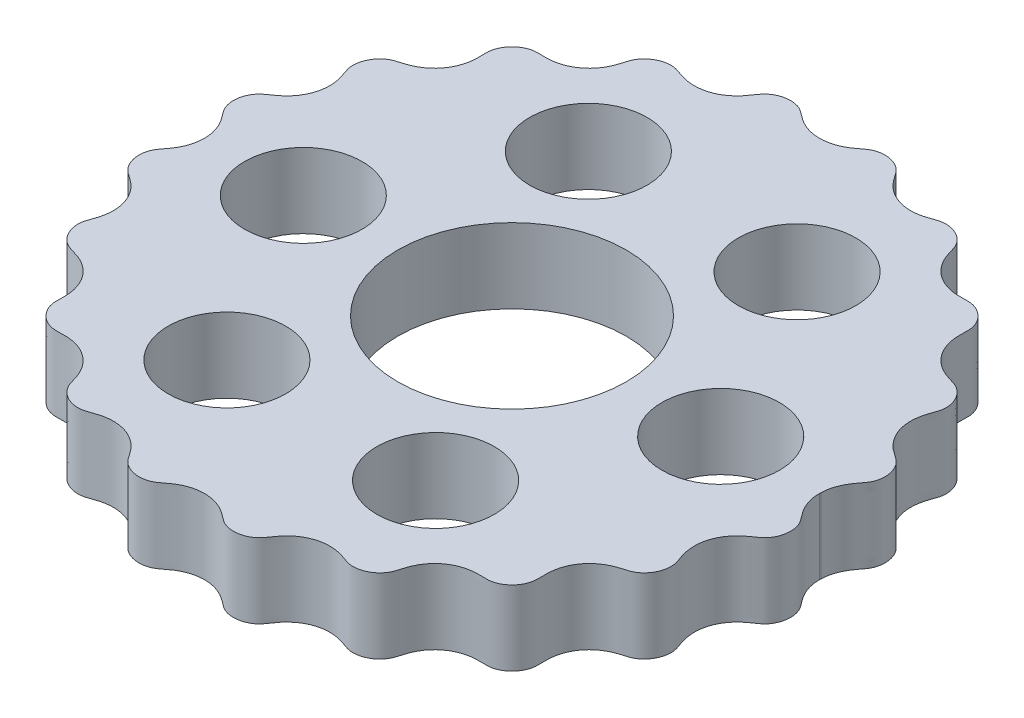
from build123d import *

# Parameters (mm, degrees)
CYCLOIDAL_BASE_SKETCH_R        = 10.4
CYCLOIDAL_BASE_EXTRUSION_DEPTH = 6.8
OUTPUT_HOLES_SKETCH_R          = 5.35
OUTPUT_HOLES_CUTOUT_DEPTH      = 43.495833342


with BuildPart() as part:
    # Cycloidal Base Sketch → Cycloidal Base Extrusion (new body)
    with BuildSketch(Plane(origin=(0, 0, 0), x_dir=(1, 0, 0), z_dir=(0, 1, 0))):
        with BuildLine():
            add(Edge.make_bspline(
                [(28, 0), (28, -0.031031349), (28.000664585, -0.077562013), (28.002880061, -0.148625962), (28.008857323, -0.265030804), (28.01748439, -0.378165866), (28.035377174, -0.532449994), (28.06975465, -0.744031815), (28.124898528, -0.988402272), (28.208291328, -1.260754977), (28.310763489, -1.527479674), (28.432264517, -1.78553412), (28.586475915, -2.065550339), (28.781240437, -2.361249596), (29.013710566, -2.671510887), (29.282434665, -2.997909262), (29.511090265, -3.399330908), (29.650641795, -3.879617947), (29.685943401, -4.415209937), (29.595050036, -4.98366351), (29.393332982, -5.482667687), (29.108390624, -5.897533807), (28.762039685, -6.207243903), (28.403477037, -6.435442884), (28.026266021, -6.701844442), (27.64319557, -7.023691154), (27.180082711, -7.524317118), (26.718464045, -8.267029277), (26.411916475, -9.252490746), (26.412585588, -10.23832478), (26.591144298, -11.003215534), (26.788245534, -11.554847613), (26.926996187, -11.920540426), (27.04353273, -12.498351115), (26.949273296, -13.292291113), (26.579231695, -14.011203462), (25.979864827, -14.553993599), (25.426081192, -14.793657027), (25.031899301, -14.895827838), (24.598577298, -15.029618089), (24.134125138, -15.214708043), (23.655411415, -15.480342094), (23.184349595, -15.840952149), (22.673753465, -16.373943796), (22.203830759, -17.12510049), (21.950799886, -17.926805445), (21.888983864, -18.704964764), (21.907789185, -19.286886173), (21.924859771, -19.675174385), (21.871149911, -20.111154063), (21.705597474, -20.571085866), (21.337846804, -21.153739973), (20.84201349, -21.573706881), (20.342413095, -21.80966339), (19.85014486, -21.905332113), (19.542764705, -21.922070062), (19.184788107, -21.90195931), (18.729055825, -21.895280733), (18.227020872, -21.931313679), (17.541142399, -22.068791717), (16.71738225, -22.413536733), (15.891229619, -23.048350202), (15.32362548, -23.857086792), (15.029931219, -24.575501935), (14.870744642, -25.131672024), (14.765974038, -25.503517496), (14.578093522, -25.897334327), (14.278137655, -26.27956758), (13.863211568, -26.621949382), (13.333466392, -26.885228535), (12.798871593, -27.009248508), (12.290552673, -27.011301219), (11.843557682, -26.90219562), (11.460571198, -26.75121757), (11.025689397, -26.60543435), (10.534018496, -26.485849414), (9.834176397, -26.408732243), (8.943191753, -26.48928166), (8.101715728, -26.795494492), (7.375116763, -27.296483528), (6.902348496, -27.776858053), (6.606598531, -28.155474042), (6.366083646, -28.513256616), (6.151840123, -28.831695176), (5.850343501, -29.143571455), (5.44849282, -29.410335403), (4.952930608, -29.603689196), (4.378140564, -29.688000673), (3.887171763, -29.648261477), (3.499857409, -29.537846694), (3.21757098, -29.405101209), (3.027395345, -29.289163366), (2.803594257, -29.123996953), (2.543296711, -28.915671476), (2.200975392, -28.666191524), (1.757738569, -28.405972128), (1.252718637, -28.191044593), (0.688410871, -28.043749551), (-0.032568257, -27.968354591), (-0.75572454, -28.038417959), (-1.447945714, -28.250687916), (-2.040364953, -28.563265751), (-2.43508463, -28.83214679), (-2.771481416, -29.097279113), (-3.073006342, -29.330941262), (-3.455359553, -29.529806436), (-3.917651053, -29.656056137), (-4.447139358, -29.684551772), (-5.019569429, -29.585408027), (-5.526314972, -29.371633211), (-5.901089956, -29.099575061), (-6.149417714, -28.82430515), (-6.342916663, -28.55017367), (-6.52768605, -28.270341803), (-6.778653094, -27.926106571), (-7.123898857, -27.541297135), (-7.542497613, -27.181412054), (-8.038978416, -26.868913717), (-8.708238445, -26.578220526), (-9.424190957, -26.427468439), (-10.153540712, -26.423523025), (-10.812857393, -26.54571293), (-11.265134105, -26.682147995), (-11.657194526, -26.828411897), (-12.003570583, -26.949288237), (-12.419349208, -27.0163226), (-12.893155845, -26.993505697), (-13.405546162, -26.856727423), (-13.922436399, -26.582438076), (-14.297340969, -26.255785564), (-14.545228892, -25.932420691), (-14.693513799, -25.653848142), (-14.777193881, -25.44474727), (-14.859768339, -25.175886882), (-14.94961111, -24.850892912), (-15.084325599, -24.444125067), (-15.297380805, -23.969854579), (-15.589092151, -23.497394056), (-15.970296988, -23.047055376), (-16.413014657, -22.662440809), (-16.905975708, -22.351506466), (-17.436562915, -22.119690928), (-17.991822389, -21.968687816), (-18.510209424, -21.903570911), (-18.979622982, -21.895472642), (-19.395216231, -21.914147378), (-19.760122128, -21.919892844), (-20.173368062, -21.852207015), (-20.613313595, -21.682775401), (-21.055976613, -21.393420873), (-21.461345683, -20.97164431), (-21.715951351, -20.543138764), (-21.850483054, -20.156060997), (-21.903595175, -19.843149855), (-21.917067504, -19.61707751), (-21.911419002, -19.334325238), (-21.896813922, -18.995552281), (-21.900821651, -18.564628351), (-21.95998452, -18.045081696), (-22.095709809, -17.503380239), (-22.324562172, -16.955868497), (-22.631906223, -16.454539193), (-23.008454099, -16.009979236), (-23.443097224, -15.630575573), (-23.923502175, -15.320894907), (-24.394614793, -15.102998218), (-24.836373872, -14.95288347), (-25.235273193, -14.843563999), (-25.58163527, -14.734658302), (-25.950103295, -14.540740978), (-26.31233868, -14.243529727), (-26.641372876, -13.831416863), (-26.894800573, -13.304359235), (-27.002946452, -12.816593176), (-27.009112874, -12.404516787), (-26.960506386, -12.089055157), (-26.901637758, -11.86907346), (-26.807460002, -11.600758064), (-26.688704284, -11.281110833), (-26.560148648, -10.867230496), (-26.458033102, -10.351364226), (-26.423156439, -9.790825053), (-26.476420934, -9.196404965), (-26.619091955, -8.624310238), (-26.844481609, -8.087344303), (-27.143662697, -7.596479599), (-27.505502372, -7.159053145), (-27.885770863, -6.810752242), (-28.258231334, -6.534623838), (-28.602197984, -6.309201905), (-28.895071379, -6.097739956), (-29.181628557, -5.798860374), (-29.430622755, -5.405352873), (-29.613193841, -4.914013425), (-29.689431096, -4.338059144), (-29.641317845, -3.842066694), (-29.519046209, -3.447630328), (-29.347230354, -3.107551616), (-29.176911045, -2.87010865), (-28.994326163, -2.643518506), (-28.784933249, -2.363547245), (-28.571500211, -2.047545383), (-28.345161016, -1.633004027), (-28.14358345, -1.107376567), (-28.017029617, -0.525985365), (-27.981859645, 0.060151868), (-28.035406584, 0.637175938), (-28.172082425, 1.192026354), (-28.383290312, 1.714776498), (-28.63818744, 2.159125147), (-28.906808596, 2.533486567), (-29.163211752, 2.852024262), (-29.373361181, 3.143662764), (-29.54964244, 3.51572955), (-29.661770312, 3.964827844), (-29.681448424, 4.487079756), (-29.574218643, 5.057988123), (-29.372915323, 5.515007066), (-29.131683637, 5.853186557), (-28.901310345, 6.081455236), (-28.71733887, 6.22699728), (-28.523830586, 6.359217381), (-28.329480908, 6.489865049), (-28.090288895, 6.658903412), (-27.789146582, 6.896331732), (-27.445538533, 7.224109569), (-27.092401473, 7.666596028), (-26.794617181, 8.185486692), (-26.584211015, 8.735334535), (-26.461833383, 9.301427774), (-26.425227124, 9.869575923), (-26.468172124, 10.427796633), (-26.57539464, 10.925269878), (-26.715902845, 11.361033992), (-26.860864887, 11.740964632), (-26.967643183, 12.082349347), (-27.016923469, 12.488849335), (-26.982539247, 12.947562526), (-26.852213504, 13.40022156), (-26.632187174, 13.825541839), (-26.365823813, 14.173243793), (-26.076266903, 14.444258568), (-25.746657166, 14.660554827), (-25.384347071, 14.803955947), (-25.013174175, 14.901888221), (-24.649825417, 15.014330048), (-24.205456498, 15.183943807), (-23.697981694, 15.448136434), (-23.19279069, 15.821811464), (-22.727598822, 16.321001516), (-22.376687134, 16.856656853), (-22.130069092, 17.402971906), (-21.978147244, 17.949424395), (-21.913956294, 18.420845127), (-21.898301955, 18.804719145), (-21.901885571, 19.098138001), (-21.910364295, 19.332599431), (-21.917356186, 19.567290625), (-21.908247038, 19.802120465), (-21.859642973, 20.123388586), (-21.728314478, 20.518321223), (-21.477258115, 20.950469614), (-21.078915406, 21.373185728), (-20.645642238, 21.664528758), (-20.217606093, 21.838212475), (-19.81395087, 21.915200378), (-19.455090494, 21.91746772), (-19.047465403, 21.897158238), (-18.587695109, 21.899303041), (-18.079419392, 21.953162665), (-17.533342209, 22.087938967), (-17.004169367, 22.301728649), (-16.505109003, 22.596039084), (-16.050057404, 22.968007225), (-15.652263558, 23.411950504), (-15.343738112, 23.88416209), (-15.140451853, 24.311413051), (-15.00916899, 24.67024555), (-14.923108555, 24.949105909), (-14.859272465, 25.17353993), (-14.793147582, 25.397519172), (-14.710914793, 25.616330064), (-14.564233641, 25.904241858), (-14.316887562, 26.236050862), (-13.944188937, 26.567290224), (-13.433671312, 26.844662271), (-12.929592484, 26.986306774), (-12.465862868, 27.016938878), (-12.056290812, 26.961980817), (-11.713377661, 26.850314018), (-11.329649416, 26.704649039), (-10.888443566, 26.565360279), (-10.384483683, 26.461685167), (-9.819320952, 26.42479376), (-9.246932195, 26.46959031), (-8.679725254, 26.601148914), (-8.13189378, 26.820596294), (-7.61790981, 27.12615642), (-7.183298081, 27.483573339), (-6.824584378, 27.869492476), (-6.564372631, 28.217104645), (-6.3750587, 28.501500012), (-6.213296167, 28.736014133), (-6.07006888, 28.913600751), (-5.843517403, 29.139305653), (-5.5063042, 29.377601905), (-5.048020671, 29.577557287), (-4.472836828, 29.682943813), (-3.946505973, 29.659706968), (-3.493869262, 29.542417914), (-3.120634811, 29.359656954), (-2.828972318, 29.144471163), (-2.506836899, 28.886341612), (-2.126888917, 28.617266556), (-1.675206917, 28.363868325), (-1.144021603, 28.156435171), (-0.582661964, 28.02636271), (-0.001890933, 27.981296185), (0.58501359, 28.025647964), (1.163951978, 28.161086845), (1.683441687, 28.36893866), (2.139888531, 28.626125065), (2.491860332, 28.876215675), (2.757963051, 29.087427108), (2.983609202, 29.258786788), (3.174495471, 29.381446804), (3.459083205, 29.523339502), (3.851854319, 29.642968902), (4.348516024, 29.689533813), (4.928039846, 29.610137785), (5.422099408, 29.422934164), (5.817403714, 29.167853492), (6.115283499, 28.874692567), (6.325372059, 28.577061424), (6.553872205, 28.230405596), (6.835248426, 27.855825213), (7.191069249, 27.474840691), (7.637712718, 27.114121837), (8.135675959, 26.820050662), (8.676257821, 26.602398199), (9.247777769, 26.468503499), (9.8372148, 26.423188442), (10.392080485, 26.463744103), (10.902188743, 26.569430587), (11.311408894, 26.699284163), (11.627802053, 26.817712849), (11.894228581, 26.909467976), (12.112860236, 26.965303648), (12.42589622, 27.009896555), (12.834025678, 27.000146678), (13.319196858, 26.889378791), (13.845153306, 26.633026021), (14.257038724, 26.299760104), (14.554041609, 25.931167483), (14.744858665, 25.556647), (14.851157653, 25.206205972), (14.962768699, 24.803779515), (15.117305141, 24.3584135), (15.404121971, 23.753955429), (15.833875149, 23.165934197), (16.374909205, 22.67403309), (17.002579382, 22.301478605), (17.547717463, 22.081681443), (18.085705531, 21.953059447), (18.600843863, 21.899006114), (19.027718225, 21.897607026), (19.363306625, 21.912804166), (19.643510312, 21.916577445), (19.867343088, 21.900617162), (20.176671824, 21.844476785), (20.558874159, 21.70781217), (20.982160211, 21.452675575), (21.399217128, 21.048510346), (21.687723584, 20.604087838), (21.85771662, 20.157247476), (21.922648534, 19.732096865), (21.91156507, 19.351655854), (21.894463869, 18.92460385), (21.908205264, 18.448223307), (22.001912439, 17.786375903), (22.234946014, 17.101808505), (22.6013126, 16.474750796), (23.084711369, 15.934134159), (23.5354966, 15.562265361), (24.006530278, 15.278421196), (24.478137245, 15.071534791), (24.881821655, 14.940491454), (25.203951204, 14.852086447), (25.469756895, 14.768372409), (25.675938251, 14.683009626), (25.950151182, 14.533002939), (26.268223191, 14.284645826), (26.589714687, 13.910902088), (26.859890893, 13.396673658), (26.995311132, 12.88281003), (27.016525018, 12.402035718), (26.942836993, 11.975508372), (26.812034137, 11.615548358), (26.66389045, 11.211678455), (26.530995558, 10.751024764), (26.419030556, 10.087782053), (26.438423676, 9.205988209), (26.682840762, 8.344460734), (27.139678155, 7.574465368), (27.613264054, 7.051514451), (27.999218433, 6.72275474), (28.373217369, 6.455649292), (28.721151792, 6.234275947), (29.073689192, 5.937225968), (29.372166962, 5.524502035), (29.586978196, 5.018911749), (29.685919297, 4.435745593), (29.653681482, 3.899251815), (29.521743881, 3.432816911), (29.315424046, 3.049403046), (29.076634529, 2.746649138), (28.854976464, 2.462422135), (28.662547192, 2.185228529), (28.501739115, 1.916498604), (28.369735291, 1.659003295), (28.256193722, 1.392681001), (28.162088593, 1.119260422), (28.097627202, 0.874181121), (28.055500454, 0.660141377), (28.032146858, 0.504627846), (28.019647513, 0.390953761), (28.009738061, 0.273140835), (28.00514711, 0.200761759), (28.002956293, 0.153593073), (28.001951271, 0.122143989)],
                knots=[0.064575154, 0.064575154, 0.064575154, 0.064575154, 0.064575154, 0.065183591, 0.06548781, 0.065792028, 0.066400465, 0.067008902, 0.068225777, 0.069442651, 0.070659525, 0.0718764, 0.073093274, 0.074310148, 0.076111476, 0.077912804, 0.079714132, 0.08151546, 0.083941756, 0.086368053, 0.088809002, 0.091249952, 0.093061606, 0.09487326, 0.096684914, 0.098496568, 0.100945225, 0.103393881, 0.108291195, 0.113292604, 0.118294014, 0.119961376, 0.121628737, 0.123296099, 0.124963461, 0.129954037, 0.134964041, 0.136701765, 0.138439489, 0.140177212, 0.141914936, 0.144438131, 0.146961326, 0.149484521, 0.152007716, 0.156981085, 0.161954454, 0.163610909, 0.165267364, 0.166923819, 0.168580274, 0.171060329, 0.173540383, 0.178580711, 0.179454318, 0.180327926, 0.18207514, 0.183822355, 0.185569569, 0.18810821, 0.190646851, 0.195724132, 0.200669307, 0.205614481, 0.207260162, 0.208905843, 0.210551525, 0.212197206, 0.214661967, 0.217126729, 0.219661961, 0.222197193, 0.223953977, 0.225710761, 0.227467545, 0.229224329, 0.231778343, 0.234332357, 0.239440385, 0.244357202, 0.246815611, 0.24927402, 0.250909074, 0.252544127, 0.254179181, 0.255814235, 0.258263652, 0.26071307, 0.263180523, 0.265647975, 0.266596818, 0.26754566, 0.268494503, 0.269443345, 0.27134103, 0.273238715, 0.2757181, 0.278197486, 0.280676871, 0.283156257, 0.288044546, 0.29048869, 0.292932834, 0.294557358, 0.296181881, 0.297806404, 0.299430928, 0.301865085, 0.304299242, 0.306781128, 0.309263013, 0.311171465, 0.312125691, 0.313079917, 0.314988369, 0.316896821, 0.319390582, 0.321884343, 0.324378105, 0.326871866, 0.331797418, 0.334260193, 0.336722969, 0.338285219, 0.33984747, 0.34140972, 0.34297197, 0.345428594, 0.347885218, 0.350381431, 0.352877644, 0.353837262, 0.35479688, 0.355756498, 0.356716116, 0.358635353, 0.360554589, 0.363062682, 0.365570774, 0.368078866, 0.370586959, 0.373033529, 0.3754801, 0.377926671, 0.380373241, 0.381927053, 0.383480864, 0.385034676, 0.386588487, 0.389029846, 0.391471206, 0.393981633, 0.39649206, 0.397457075, 0.39842209, 0.399387105, 0.40035212, 0.402282151, 0.404212181, 0.406734559, 0.409256937, 0.411779314, 0.414301692, 0.41673198, 0.419162268, 0.421592556, 0.424022844, 0.425568398, 0.427113953, 0.428659507, 0.430205061, 0.432631132, 0.435057203, 0.437581726, 0.440106249, 0.441076661, 0.442047073, 0.443017486, 0.443987898, 0.445928723, 0.447869547, 0.450406163, 0.452942779, 0.455479396, 0.458016012, 0.460429941, 0.462843871, 0.465257801, 0.467671731, 0.469209216, 0.4707467, 0.472284185, 0.47382167, 0.476232438, 0.478643206, 0.481151977, 0.483660747, 0.484655025, 0.485649303, 0.487637859, 0.488632137, 0.489626415, 0.491614971, 0.494143736, 0.496672502, 0.499201267, 0.501730032, 0.50412753, 0.506525028, 0.508922526, 0.511320024, 0.512849634, 0.514379244, 0.515908855, 0.517438465, 0.519833922, 0.52222938, 0.524752243, 0.527275106, 0.528274831, 0.529274556, 0.530274281, 0.531274006, 0.532273731, 0.533273456, 0.535272906, 0.537815564, 0.540358222, 0.54290088, 0.545443538, 0.547824532, 0.550205527, 0.552586522, 0.554967517, 0.556489453, 0.558011389, 0.559533325, 0.561055261, 0.56343541, 0.565815558, 0.567501957, 0.569188355, 0.570874754, 0.572561152, 0.5741835, 0.575805847, 0.577428195, 0.579050543, 0.582295238, 0.585539933, 0.58808731, 0.590634686, 0.593182062, 0.595729438, 0.59773259, 0.598734166, 0.599735743, 0.600737319, 0.601738895, 0.602740471, 0.603742047, 0.606269677, 0.608797307, 0.611187553, 0.613577799, 0.615104774, 0.616631749, 0.618158724, 0.619685699, 0.622077587, 0.624469475, 0.626861363, 0.629253251, 0.631786751, 0.63432025, 0.63685375, 0.639387249, 0.641379516, 0.64237565, 0.643371783, 0.644367917, 0.64536405, 0.646360184, 0.647356317, 0.6498699, 0.652383483, 0.654789039, 0.657194596, 0.658729378, 0.66026416, 0.661798942, 0.663333725, 0.665742069, 0.668150414, 0.670558758, 0.672967102, 0.675508554, 0.678050006, 0.680591458, 0.68313291, 0.685077407, 0.687021905, 0.687994154, 0.688966403, 0.689938651, 0.6909109, 0.693440193, 0.695969486, 0.698390349, 0.700811213, 0.702353998, 0.703896784, 0.70543957, 0.706982356, 0.709407084, 0.711831812, 0.71425654, 0.716681268, 0.719208498, 0.721735728, 0.724262958, 0.726790188, 0.728723893, 0.730657598, 0.731624451, 0.732591303, 0.733558156, 0.734525008, 0.737040247, 0.739555486, 0.741991643, 0.744427801, 0.745978781, 0.747529761, 0.749080741, 0.75063172, 0.753072757, 0.755513794, 0.75795483, 0.760395867, 0.762908827, 0.765421788, 0.767934748, 0.770447708, 0.772370618, 0.774293529, 0.775254984, 0.776216439, 0.777177894, 0.778139349, 0.780640413, 0.783141477, 0.785592908, 0.78804434, 0.789603697, 0.791163055, 0.792722413, 0.79428177, 0.796739039, 0.799196307, 0.804110844, 0.806609488, 0.809108133, 0.811606778, 0.814105422, 0.816017544, 0.817929665, 0.818885726, 0.819841786, 0.820797847, 0.821753908, 0.824240683, 0.826727458, 0.829156674, 0.831585891, 0.833206737, 0.834827583, 0.83644843, 0.838069276, 0.840508545, 0.842947813, 0.84782635, 0.850310634, 0.852794918, 0.855279202, 0.857763486, 0.859664834, 0.861566181, 0.862516855, 0.863467529, 0.864418203, 0.865368876, 0.867841254, 0.870313631, 0.872757815, 0.875201999, 0.876833471, 0.878464943, 0.880096415, 0.881727888, 0.88418145, 0.886635013, 0.891542139, 0.8966606, 0.89921983, 0.901779061, 0.903539119, 0.905299177, 0.907059235, 0.908819293, 0.911359631, 0.91389997, 0.916359513, 0.918819057, 0.920461103, 0.92210315, 0.923745196, 0.925387243, 0.926621128, 0.927855013, 0.929088898, 0.930322783, 0.931556668, 0.932790553, 0.933407496, 0.934024438, 0.93433291, 0.934641381, 0.935258323, 0.935258323, 0.935258323, 0.935258323, 0.935258323], degree=4))
            Line((28.001951271, 0.122143989), (28, 0))
        make_face()
        Circle(CYCLOIDAL_BASE_SKETCH_R, mode=Mode.SUBTRACT)
    extrude(amount=CYCLOIDAL_BASE_EXTRUSION_DEPTH)

    # Output Holes Sketch → Output Holes Cutout (cut, through all)
    with BuildSketch(Plane(origin=(0, 6.8, 0), x_dir=(1, 0, 0), z_dir=(0, 1, 0))):
        with Locations((-19, 0)):
            Circle(OUTPUT_HOLES_SKETCH_R)
        with Locations((-9.5, 16.454482672)):
            Circle(OUTPUT_HOLES_SKETCH_R)
        with Locations((9.5, 16.454482672)):
            Circle(OUTPUT_HOLES_SKETCH_R)
        with Locations((19, 0)):
            Circle(OUTPUT_HOLES_SKETCH_R)
        with Locations((9.5, -16.454482672)):
            Circle(OUTPUT_HOLES_SKETCH_R)
        with Locations((-9.5, -16.454482672)):
            Circle(OUTPUT_HOLES_SKETCH_R)
    extrude(amount=-OUTPUT_HOLES_CUTOUT_DEPTH, mode=Mode.SUBTRACT)


solid = part.part
